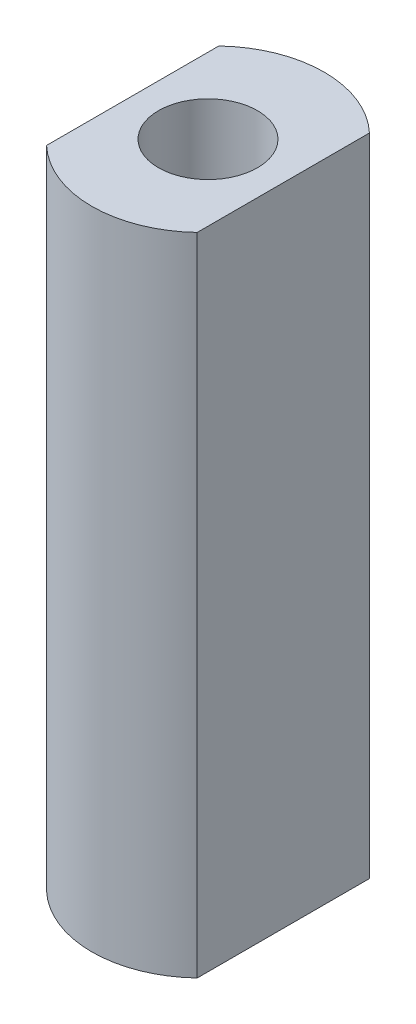
from build123d import *

# Parameters (mm, degrees)
SKETCH1_R           = 1.15
BOSS_EXTRUDE1_DEPTH = 15


with BuildPart() as part:
    # Sketch1 → Boss-Extrude1 (new body)
    with BuildSketch(Plane(origin=(0, 0, 0), x_dir=(1, 0, 0), z_dir=(0, 1, 0))):
        with BuildLine():
            Line((-1.75, 2), (-1.75, -2))
            ThreePointArc((-1.75, -2), (0, -2.7), (1.75, -2))
            Line((1.75, -2), (1.75, 2))
            ThreePointArc((1.75, 2), (0, 2.7), (-1.75, 2))
        make_face()
        with Locations(Location((0, 0, 0), (0, 0, 270))):
            Circle(SKETCH1_R, mode=Mode.SUBTRACT)
    extrude(amount=BOSS_EXTRUDE1_DEPTH)


solid = part.part
